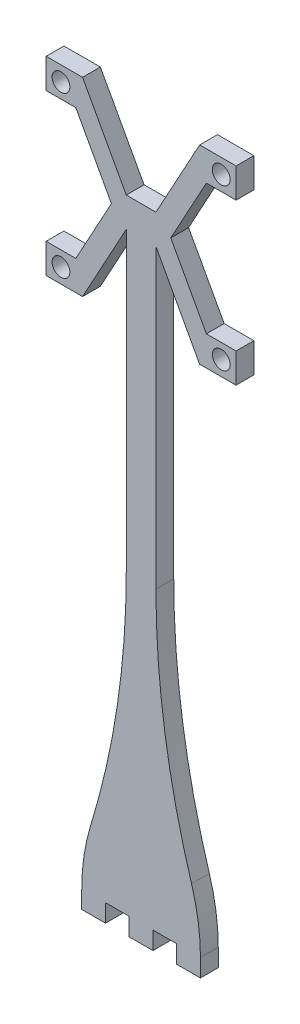
from build123d import *

# Parameters (mm, degrees)
SKETCH1_R           = 1.5
BOSS_EXTRUDE1_DEPTH = 3


with BuildPart() as part:
    # Sketch1 → Boss-Extrude1 (new body)
    with BuildSketch(Plane.XY):
        with BuildLine():
            Line((-10, 0), (-10, 3))
            ThreePointArc((-10, 3), (-9.622914027, 8.055937104), (-8.5, 13))
            ThreePointArc((-8.5, 13), (-4.008343892, 32.776251584), (-2.5, 53))
            Line((-2.5, 53), (-2.5, 103))
            Line((-2.5, 103), (-9.863636364, 89.5))
            Line((-9.863636364, 89.5), (-16, 89.5))
            Line((-16, 89.5), (-16, 94.5))
            Line((-16, 94.5), (-11, 94.5))
            Line((-11, 94.5), (-5, 105.5))
            Line((-5, 105.5), (-11, 116.5))
            Line((-11, 116.5), (-16, 116.5))
            Line((-16, 116.5), (-16, 121.5))
            Line((-16, 121.5), (-9.863636364, 121.5))
            Line((-9.863636364, 121.5), (-2.5, 108))
            Line((-2.5, 108), (2.5, 108))
            Line((2.5, 108), (9.863636364, 121.5))
            Line((9.863636364, 121.5), (16, 121.5))
            Line((16, 121.5), (16, 116.5))
            Line((16, 116.5), (11, 116.5))
            Line((11, 116.5), (5, 105.5))
            Line((5, 105.5), (11, 94.5))
            Line((11, 94.5), (16, 94.5))
            Line((16, 94.5), (16, 89.5))
            Line((16, 89.5), (9.863636364, 89.5))
            Line((9.863636364, 89.5), (2.5, 103))
            Line((2.5, 103), (2.5, 53))
            ThreePointArc((2.5, 53), (4.008343892, 32.776251584), (8.5, 13))
            ThreePointArc((8.5, 13), (9.622914027, 8.055937104), (10, 3))
            Line((10, 3), (10, 0))
            Line((10, 0), (6, 0))
            Line((6, 0), (6, 3))
            Line((6, 3), (2, 3))
            Line((2, 3), (2, 0))
            Line((2, 0), (-2, 0))
            Line((-2, 0), (-2, 3))
            Line((-2, 3), (-6, 3))
            Line((-6, 3), (-6, 0))
            Line((-6, 0), (-10, 0))
        make_face()
        with Locations((-13.5, 92)):
            Circle(SKETCH1_R, mode=Mode.SUBTRACT)
        with Locations(Location((13.5, 92, 0), (0, 0, 180))):
            Circle(SKETCH1_R, mode=Mode.SUBTRACT)
        with Locations((13.5, 119)):
            Circle(SKETCH1_R, mode=Mode.SUBTRACT)
        with Locations(Location((-13.5, 119, 0), (0, 0, 180))):
            Circle(SKETCH1_R, mode=Mode.SUBTRACT)
    extrude(amount=BOSS_EXTRUDE1_DEPTH)


solid = part.part
